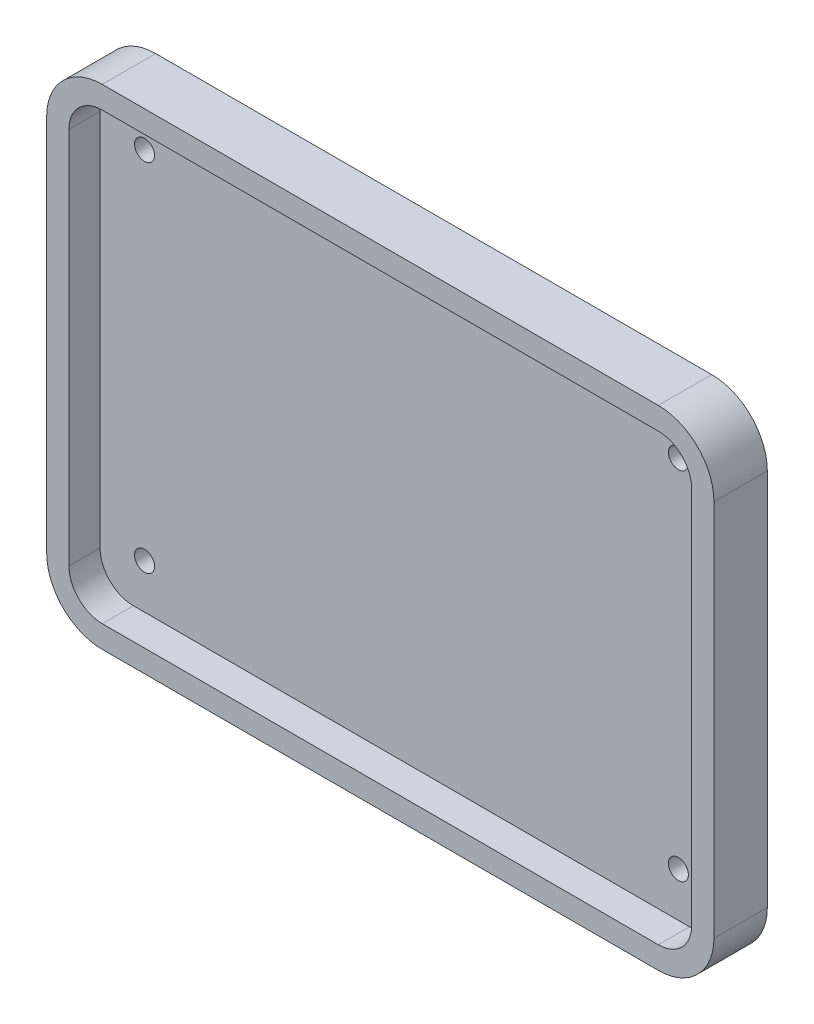
from build123d import *

# Parameters (mm, degrees)
SKETCH_1_W          = 150
SKETCH_1_H          = 110
EXTRUDE_1_DEPTH     = 12
FILLET_1_R          = 12.5
SHELL_1_T           = -5
SKETCH_3_R          = 2.25
CUT_EXTRUDE_1_DEPTH = 94.268429814


with BuildPart() as part:
    # 草图1 → 凸台-拉伸1 (new body)
    with BuildSketch(Plane.XY):
        Rectangle(SKETCH_1_W, SKETCH_1_H)
    extrude(amount=EXTRUDE_1_DEPTH)

    # 圆角1
    fillet_1_edges = [part.edges().sort_by_distance(p)[0] for p in [
        (75, -55, 6),
        (-75, -55, 6),
        (-75, 55, 6),
        (75, 55, 6),
    ]]
    fillet(fillet_1_edges, radius=FILLET_1_R)

    # 抽壳1
    shell_1_openings = [part.faces().sort_by_distance(p)[0] for p in [
        (0, 0, 12),
    ]]
    offset(amount=SHELL_1_T, openings=shell_1_openings, kind=Kind.INTERSECTION)

    # 草图3 → 切除-拉伸1 (cut, through all)
    with BuildSketch(Plane.XY.offset(5)):
        with Locations((-60, 40)):
            Circle(SKETCH_3_R)
        with Locations((60, 40)):
            Circle(SKETCH_3_R)
        with Locations(Location((60, -40, 0), (0, 0, 180))):
            Circle(SKETCH_3_R)
        with Locations(Location((-60, -40, 0), (0, 0, 180))):
            Circle(SKETCH_3_R)
    extrude(amount=-CUT_EXTRUDE_1_DEPTH, mode=Mode.SUBTRACT)


solid = part.part
